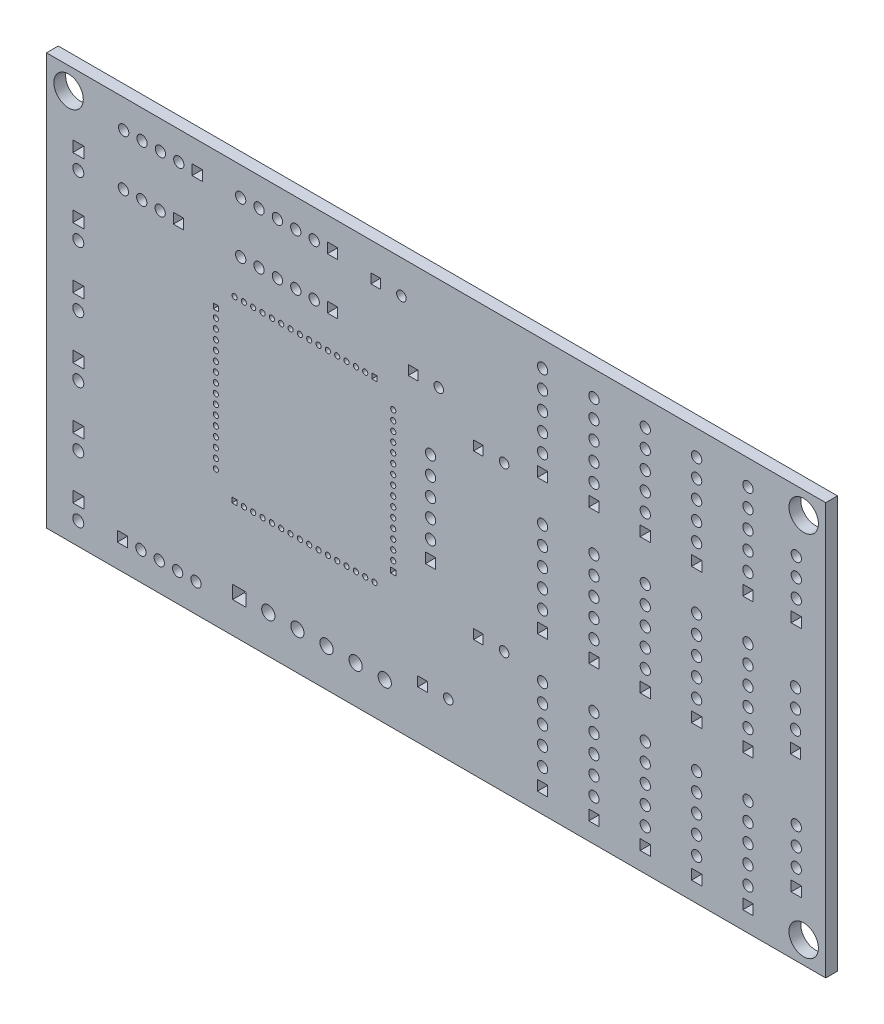
from build123d import *

# Parameters (mm, degrees)
MODEL_W             = 106
MODEL_H             = 56
MODEL_R             = 0.35
MODEL_R_2           = 0.75
MODEL_R_3           = 0.9
MODEL_R_4           = 0.7
MODEL_R_5           = 0.65
MODEL_R_6           = 2
MODEL_W_2           = 0.7
MODEL_H_2           = 0.7
MODEL_W_3           = 1.5
MODEL_H_3           = 1.5
MODEL_W_4           = 1.8
MODEL_H_4           = 1.8
MODEL_W_5           = 1.4
MODEL_H_5           = 1.4
MODEL_W_6           = 1.3
MODEL_H_6           = 1.3
BOSS_EXTRUDE1_DEPTH = 1.6


with BuildPart() as part:
    # Model → Boss-Extrude1 (new body)
    with BuildSketch(Plane.XY):
        with Locations((53, 28)):
            Rectangle(MODEL_W, MODEL_H)
        with Locations((23.035, 36.255)):
            Circle(MODEL_R, mode=Mode.SUBTRACT)
        with Locations((23.035, 34.985)):
            Circle(MODEL_R, mode=Mode.SUBTRACT)
        with Locations((23.035, 33.715)):
            Circle(MODEL_R, mode=Mode.SUBTRACT)
        with Locations((23.035, 32.445)):
            Circle(MODEL_R, mode=Mode.SUBTRACT)
        with Locations((23.035, 31.175)):
            Circle(MODEL_R, mode=Mode.SUBTRACT)
        with Locations((23.035, 29.905)):
            Circle(MODEL_R, mode=Mode.SUBTRACT)
        with Locations((23.035, 28.635)):
            Circle(MODEL_R, mode=Mode.SUBTRACT)
        with Locations((23.035, 27.365)):
            Circle(MODEL_R, mode=Mode.SUBTRACT)
        with Locations((23.035, 26.095)):
            Circle(MODEL_R, mode=Mode.SUBTRACT)
        with Locations((23.035, 24.825)):
            Circle(MODEL_R, mode=Mode.SUBTRACT)
        with Locations((23.035, 23.555)):
            Circle(MODEL_R, mode=Mode.SUBTRACT)
        with Locations((23.035, 22.285)):
            Circle(MODEL_R, mode=Mode.SUBTRACT)
        with Locations((23.035, 21.015)):
            Circle(MODEL_R, mode=Mode.SUBTRACT)
        with Locations((23.035, 19.745)):
            Circle(MODEL_R, mode=Mode.SUBTRACT)
        with Locations((23.035, 18.475)):
            Circle(MODEL_R, mode=Mode.SUBTRACT)
        with Locations((26.845, 15.935)):
            Circle(MODEL_R, mode=Mode.SUBTRACT)
        with Locations((28.115, 15.935)):
            Circle(MODEL_R, mode=Mode.SUBTRACT)
        with Locations((29.385, 15.935)):
            Circle(MODEL_R, mode=Mode.SUBTRACT)
        with Locations((30.655, 15.935)):
            Circle(MODEL_R, mode=Mode.SUBTRACT)
        with Locations((31.925, 15.935)):
            Circle(MODEL_R, mode=Mode.SUBTRACT)
        with Locations((33.195, 15.935)):
            Circle(MODEL_R, mode=Mode.SUBTRACT)
        with Locations((34.465, 15.935)):
            Circle(MODEL_R, mode=Mode.SUBTRACT)
        with Locations((35.735, 15.935)):
            Circle(MODEL_R, mode=Mode.SUBTRACT)
        with Locations((37.005, 15.935)):
            Circle(MODEL_R, mode=Mode.SUBTRACT)
        with Locations((38.275, 15.935)):
            Circle(MODEL_R, mode=Mode.SUBTRACT)
        with Locations((39.545, 15.935)):
            Circle(MODEL_R, mode=Mode.SUBTRACT)
        with Locations((40.815, 15.935)):
            Circle(MODEL_R, mode=Mode.SUBTRACT)
        with Locations((42.085, 15.935)):
            Circle(MODEL_R, mode=Mode.SUBTRACT)
        with Locations((43.355, 15.935)):
            Circle(MODEL_R, mode=Mode.SUBTRACT)
        with Locations((44.625, 15.935)):
            Circle(MODEL_R, mode=Mode.SUBTRACT)
        with Locations((47.165, 19.745)):
            Circle(MODEL_R, mode=Mode.SUBTRACT)
        with Locations((47.165, 21.015)):
            Circle(MODEL_R, mode=Mode.SUBTRACT)
        with Locations((47.165, 22.285)):
            Circle(MODEL_R, mode=Mode.SUBTRACT)
        with Locations((47.165, 23.555)):
            Circle(MODEL_R, mode=Mode.SUBTRACT)
        with Locations((47.165, 24.825)):
            Circle(MODEL_R, mode=Mode.SUBTRACT)
        with Locations((47.165, 26.095)):
            Circle(MODEL_R, mode=Mode.SUBTRACT)
        with Locations((47.165, 27.365)):
            Circle(MODEL_R, mode=Mode.SUBTRACT)
        with Locations((47.165, 28.635)):
            Circle(MODEL_R, mode=Mode.SUBTRACT)
        with Locations((47.165, 29.905)):
            Circle(MODEL_R, mode=Mode.SUBTRACT)
        with Locations((47.165, 31.175)):
            Circle(MODEL_R, mode=Mode.SUBTRACT)
        with Locations((47.165, 32.445)):
            Circle(MODEL_R, mode=Mode.SUBTRACT)
        with Locations((47.165, 33.715)):
            Circle(MODEL_R, mode=Mode.SUBTRACT)
        with Locations((47.165, 34.985)):
            Circle(MODEL_R, mode=Mode.SUBTRACT)
        with Locations((47.165, 36.255)):
            Circle(MODEL_R, mode=Mode.SUBTRACT)
        with Locations((47.165, 37.525)):
            Circle(MODEL_R, mode=Mode.SUBTRACT)
        with Locations((43.355, 40.065)):
            Circle(MODEL_R, mode=Mode.SUBTRACT)
        with Locations((42.085, 40.065)):
            Circle(MODEL_R, mode=Mode.SUBTRACT)
        with Locations((40.815, 40.065)):
            Circle(MODEL_R, mode=Mode.SUBTRACT)
        with Locations((39.545, 40.065)):
            Circle(MODEL_R, mode=Mode.SUBTRACT)
        with Locations((38.275, 40.065)):
            Circle(MODEL_R, mode=Mode.SUBTRACT)
        with Locations((37.005, 40.065)):
            Circle(MODEL_R, mode=Mode.SUBTRACT)
        with Locations((35.735, 40.065)):
            Circle(MODEL_R, mode=Mode.SUBTRACT)
        with Locations((34.465, 40.065)):
            Circle(MODEL_R, mode=Mode.SUBTRACT)
        with Locations((33.195, 40.065)):
            Circle(MODEL_R, mode=Mode.SUBTRACT)
        with Locations((31.925, 40.065)):
            Circle(MODEL_R, mode=Mode.SUBTRACT)
        with Locations((30.655, 40.065)):
            Circle(MODEL_R, mode=Mode.SUBTRACT)
        with Locations((29.385, 40.065)):
            Circle(MODEL_R, mode=Mode.SUBTRACT)
        with Locations((28.115, 40.065)):
            Circle(MODEL_R, mode=Mode.SUBTRACT)
        with Locations((26.845, 40.065)):
            Circle(MODEL_R, mode=Mode.SUBTRACT)
        with Locations((25.575, 40.065)):
            Circle(MODEL_R, mode=Mode.SUBTRACT)
        with Locations((4.32, 44.29)):
            Circle(MODEL_R_2, mode=Mode.SUBTRACT)
        with Locations((4.32, 36.035)):
            Circle(MODEL_R_2, mode=Mode.SUBTRACT)
        with Locations((4.32, 27.78)):
            Circle(MODEL_R_2, mode=Mode.SUBTRACT)
        with Locations((4.32, 19.525)):
            Circle(MODEL_R_2, mode=Mode.SUBTRACT)
        with Locations((4.32, 11.27)):
            Circle(MODEL_R_2, mode=Mode.SUBTRACT)
        with Locations((4.32, 3.015)):
            Circle(MODEL_R_2, mode=Mode.SUBTRACT)
        with Locations((30.17, 5.14)):
            Circle(MODEL_R_3, mode=Mode.SUBTRACT)
        with Locations((34.13, 5.14)):
            Circle(MODEL_R_3, mode=Mode.SUBTRACT)
        with Locations((38.09, 5.14)):
            Circle(MODEL_R_3, mode=Mode.SUBTRACT)
        with Locations((42.05, 5.14)):
            Circle(MODEL_R_3, mode=Mode.SUBTRACT)
        with Locations((46.01, 5.14)):
            Circle(MODEL_R_3, mode=Mode.SUBTRACT)
        with Locations((67.485, 5.6)):
            Circle(MODEL_R_4, mode=Mode.SUBTRACT)
        with Locations((67.485, 8.1)):
            Circle(MODEL_R_4, mode=Mode.SUBTRACT)
        with Locations((67.485, 10.6)):
            Circle(MODEL_R_4, mode=Mode.SUBTRACT)
        with Locations((67.485, 13.1)):
            Circle(MODEL_R_4, mode=Mode.SUBTRACT)
        with Locations((67.485, 15.6)):
            Circle(MODEL_R_4, mode=Mode.SUBTRACT)
        with Locations((74.47, 5.6)):
            Circle(MODEL_R_4, mode=Mode.SUBTRACT)
        with Locations((74.47, 8.1)):
            Circle(MODEL_R_4, mode=Mode.SUBTRACT)
        with Locations((74.47, 10.6)):
            Circle(MODEL_R_4, mode=Mode.SUBTRACT)
        with Locations((74.47, 13.1)):
            Circle(MODEL_R_4, mode=Mode.SUBTRACT)
        with Locations((74.47, 15.6)):
            Circle(MODEL_R_4, mode=Mode.SUBTRACT)
        with Locations((81.455, 5.6)):
            Circle(MODEL_R_4, mode=Mode.SUBTRACT)
        with Locations((81.455, 8.1)):
            Circle(MODEL_R_4, mode=Mode.SUBTRACT)
        with Locations((81.455, 10.6)):
            Circle(MODEL_R_4, mode=Mode.SUBTRACT)
        with Locations((81.455, 13.1)):
            Circle(MODEL_R_4, mode=Mode.SUBTRACT)
        with Locations((81.455, 15.6)):
            Circle(MODEL_R_4, mode=Mode.SUBTRACT)
        with Locations((88.44, 5.6)):
            Circle(MODEL_R_4, mode=Mode.SUBTRACT)
        with Locations((88.44, 8.1)):
            Circle(MODEL_R_4, mode=Mode.SUBTRACT)
        with Locations((88.44, 10.6)):
            Circle(MODEL_R_4, mode=Mode.SUBTRACT)
        with Locations((88.44, 13.1)):
            Circle(MODEL_R_4, mode=Mode.SUBTRACT)
        with Locations((88.44, 15.6)):
            Circle(MODEL_R_4, mode=Mode.SUBTRACT)
        with Locations((95.425, 5.6)):
            Circle(MODEL_R_4, mode=Mode.SUBTRACT)
        with Locations((95.425, 8.1)):
            Circle(MODEL_R_4, mode=Mode.SUBTRACT)
        with Locations((95.425, 10.6)):
            Circle(MODEL_R_4, mode=Mode.SUBTRACT)
        with Locations((95.425, 13.1)):
            Circle(MODEL_R_4, mode=Mode.SUBTRACT)
        with Locations((95.425, 15.6)):
            Circle(MODEL_R_4, mode=Mode.SUBTRACT)
        with Locations((67.485, 24.15)):
            Circle(MODEL_R_4, mode=Mode.SUBTRACT)
        with Locations((67.485, 26.65)):
            Circle(MODEL_R_4, mode=Mode.SUBTRACT)
        with Locations((67.485, 29.15)):
            Circle(MODEL_R_4, mode=Mode.SUBTRACT)
        with Locations((67.485, 31.65)):
            Circle(MODEL_R_4, mode=Mode.SUBTRACT)
        with Locations((67.485, 34.15)):
            Circle(MODEL_R_4, mode=Mode.SUBTRACT)
        with Locations((74.47, 24.15)):
            Circle(MODEL_R_4, mode=Mode.SUBTRACT)
        with Locations((74.47, 26.65)):
            Circle(MODEL_R_4, mode=Mode.SUBTRACT)
        with Locations((74.47, 29.15)):
            Circle(MODEL_R_4, mode=Mode.SUBTRACT)
        with Locations((74.47, 31.65)):
            Circle(MODEL_R_4, mode=Mode.SUBTRACT)
        with Locations((74.47, 34.15)):
            Circle(MODEL_R_4, mode=Mode.SUBTRACT)
        with Locations((81.455, 24.15)):
            Circle(MODEL_R_4, mode=Mode.SUBTRACT)
        with Locations((81.455, 26.65)):
            Circle(MODEL_R_4, mode=Mode.SUBTRACT)
        with Locations((81.455, 29.15)):
            Circle(MODEL_R_4, mode=Mode.SUBTRACT)
        with Locations((81.455, 31.65)):
            Circle(MODEL_R_4, mode=Mode.SUBTRACT)
        with Locations((81.455, 34.15)):
            Circle(MODEL_R_4, mode=Mode.SUBTRACT)
        with Locations((88.44, 24.15)):
            Circle(MODEL_R_4, mode=Mode.SUBTRACT)
        with Locations((88.44, 26.65)):
            Circle(MODEL_R_4, mode=Mode.SUBTRACT)
        with Locations((88.44, 29.15)):
            Circle(MODEL_R_4, mode=Mode.SUBTRACT)
        with Locations((88.44, 31.65)):
            Circle(MODEL_R_4, mode=Mode.SUBTRACT)
        with Locations((88.44, 34.15)):
            Circle(MODEL_R_4, mode=Mode.SUBTRACT)
        with Locations((95.425, 24.15)):
            Circle(MODEL_R_4, mode=Mode.SUBTRACT)
        with Locations((95.425, 26.65)):
            Circle(MODEL_R_4, mode=Mode.SUBTRACT)
        with Locations((95.425, 29.15)):
            Circle(MODEL_R_4, mode=Mode.SUBTRACT)
        with Locations((95.425, 31.65)):
            Circle(MODEL_R_4, mode=Mode.SUBTRACT)
        with Locations((95.425, 34.15)):
            Circle(MODEL_R_4, mode=Mode.SUBTRACT)
        with Locations((67.485, 42.565)):
            Circle(MODEL_R_4, mode=Mode.SUBTRACT)
        with Locations((67.485, 45.065)):
            Circle(MODEL_R_4, mode=Mode.SUBTRACT)
        with Locations((67.485, 47.565)):
            Circle(MODEL_R_4, mode=Mode.SUBTRACT)
        with Locations((67.485, 50.065)):
            Circle(MODEL_R_4, mode=Mode.SUBTRACT)
        with Locations((67.485, 52.565)):
            Circle(MODEL_R_4, mode=Mode.SUBTRACT)
        with Locations((74.47, 42.565)):
            Circle(MODEL_R_4, mode=Mode.SUBTRACT)
        with Locations((74.47, 45.065)):
            Circle(MODEL_R_4, mode=Mode.SUBTRACT)
        with Locations((74.47, 47.565)):
            Circle(MODEL_R_4, mode=Mode.SUBTRACT)
        with Locations((74.47, 50.065)):
            Circle(MODEL_R_4, mode=Mode.SUBTRACT)
        with Locations((74.47, 52.565)):
            Circle(MODEL_R_4, mode=Mode.SUBTRACT)
        with Locations((81.455, 42.565)):
            Circle(MODEL_R_4, mode=Mode.SUBTRACT)
        with Locations((81.455, 45.065)):
            Circle(MODEL_R_4, mode=Mode.SUBTRACT)
        with Locations((81.455, 47.565)):
            Circle(MODEL_R_4, mode=Mode.SUBTRACT)
        with Locations((81.455, 50.065)):
            Circle(MODEL_R_4, mode=Mode.SUBTRACT)
        with Locations((81.455, 52.565)):
            Circle(MODEL_R_4, mode=Mode.SUBTRACT)
        with Locations((88.44, 42.565)):
            Circle(MODEL_R_4, mode=Mode.SUBTRACT)
        with Locations((88.44, 45.065)):
            Circle(MODEL_R_4, mode=Mode.SUBTRACT)
        with Locations((88.44, 47.565)):
            Circle(MODEL_R_4, mode=Mode.SUBTRACT)
        with Locations((88.44, 50.065)):
            Circle(MODEL_R_4, mode=Mode.SUBTRACT)
        with Locations((88.44, 52.565)):
            Circle(MODEL_R_4, mode=Mode.SUBTRACT)
        with Locations((95.425, 42.565)):
            Circle(MODEL_R_4, mode=Mode.SUBTRACT)
        with Locations((95.425, 45.065)):
            Circle(MODEL_R_4, mode=Mode.SUBTRACT)
        with Locations((95.425, 47.565)):
            Circle(MODEL_R_4, mode=Mode.SUBTRACT)
        with Locations((95.425, 50.065)):
            Circle(MODEL_R_4, mode=Mode.SUBTRACT)
        with Locations((95.425, 52.565)):
            Circle(MODEL_R_4, mode=Mode.SUBTRACT)
        with Locations((36.41, 52.13)):
            Circle(MODEL_R_4, mode=Mode.SUBTRACT)
        with Locations((33.91, 52.13)):
            Circle(MODEL_R_4, mode=Mode.SUBTRACT)
        with Locations((31.41, 52.13)):
            Circle(MODEL_R_4, mode=Mode.SUBTRACT)
        with Locations((28.91, 52.13)):
            Circle(MODEL_R_4, mode=Mode.SUBTRACT)
        with Locations((26.41, 52.13)):
            Circle(MODEL_R_4, mode=Mode.SUBTRACT)
        with Locations((36.41, 45.145)):
            Circle(MODEL_R_4, mode=Mode.SUBTRACT)
        with Locations((33.91, 45.145)):
            Circle(MODEL_R_4, mode=Mode.SUBTRACT)
        with Locations((31.41, 45.145)):
            Circle(MODEL_R_4, mode=Mode.SUBTRACT)
        with Locations((28.91, 45.145)):
            Circle(MODEL_R_4, mode=Mode.SUBTRACT)
        with Locations((26.41, 45.145)):
            Circle(MODEL_R_4, mode=Mode.SUBTRACT)
        with Locations((52.245, 24.785)):
            Circle(MODEL_R_4, mode=Mode.SUBTRACT)
        with Locations((52.245, 27.285)):
            Circle(MODEL_R_4, mode=Mode.SUBTRACT)
        with Locations((52.245, 29.785)):
            Circle(MODEL_R_4, mode=Mode.SUBTRACT)
        with Locations((52.245, 32.285)):
            Circle(MODEL_R_4, mode=Mode.SUBTRACT)
        with Locations((52.245, 34.785)):
            Circle(MODEL_R_4, mode=Mode.SUBTRACT)
        with Locations((17.995, 52.13)):
            Circle(MODEL_R_4, mode=Mode.SUBTRACT)
        with Locations((15.495, 52.13)):
            Circle(MODEL_R_4, mode=Mode.SUBTRACT)
        with Locations((12.995, 52.13)):
            Circle(MODEL_R_4, mode=Mode.SUBTRACT)
        with Locations((10.495, 52.13)):
            Circle(MODEL_R_4, mode=Mode.SUBTRACT)
        with Locations((12.835, 3.87)):
            Circle(MODEL_R_4, mode=Mode.SUBTRACT)
        with Locations((15.335, 3.87)):
            Circle(MODEL_R_4, mode=Mode.SUBTRACT)
        with Locations((17.835, 3.87)):
            Circle(MODEL_R_4, mode=Mode.SUBTRACT)
        with Locations((20.335, 3.87)):
            Circle(MODEL_R_4, mode=Mode.SUBTRACT)
        with Locations((15.455, 45.145)):
            Circle(MODEL_R_4, mode=Mode.SUBTRACT)
        with Locations((12.955, 45.145)):
            Circle(MODEL_R_4, mode=Mode.SUBTRACT)
        with Locations((10.455, 45.145)):
            Circle(MODEL_R_4, mode=Mode.SUBTRACT)
        with Locations((102, 42.7)):
            Circle(MODEL_R_4, mode=Mode.SUBTRACT)
        with Locations((102, 45.2)):
            Circle(MODEL_R_4, mode=Mode.SUBTRACT)
        with Locations((102, 47.7)):
            Circle(MODEL_R_4, mode=Mode.SUBTRACT)
        with Locations((101.9, 27.2)):
            Circle(MODEL_R_4, mode=Mode.SUBTRACT)
        with Locations((101.9, 29.7)):
            Circle(MODEL_R_4, mode=Mode.SUBTRACT)
        with Locations((101.9, 32.2)):
            Circle(MODEL_R_4, mode=Mode.SUBTRACT)
        with Locations((102, 11)):
            Circle(MODEL_R_4, mode=Mode.SUBTRACT)
        with Locations((102, 13.5)):
            Circle(MODEL_R_4, mode=Mode.SUBTRACT)
        with Locations((102, 16)):
            Circle(MODEL_R_4, mode=Mode.SUBTRACT)
        with Locations((54.65, 7.2)):
            Circle(MODEL_R_5, mode=Mode.SUBTRACT)
        with Locations((62.25, 16.57)):
            Circle(MODEL_R_5, mode=Mode.SUBTRACT)
        with Locations((62.25, 38.795)):
            Circle(MODEL_R_5, mode=Mode.SUBTRACT)
        with Locations((48.28, 51.495)):
            Circle(MODEL_R_5, mode=Mode.SUBTRACT)
        with Locations((53.36, 43.24)):
            Circle(MODEL_R_5, mode=Mode.SUBTRACT)
        with Locations((3, 53)):
            Circle(MODEL_R_6, mode=Mode.SUBTRACT)
        with Locations((103, 3)):
            Circle(MODEL_R_6, mode=Mode.SUBTRACT)
        with Locations((103, 53)):
            Circle(MODEL_R_6, mode=Mode.SUBTRACT)
        with Locations((23.035, 37.525)):
            Rectangle(MODEL_W_2, MODEL_H_2, mode=Mode.SUBTRACT)
        with Locations((25.575, 15.935)):
            Rectangle(MODEL_W_2, MODEL_H_2, mode=Mode.SUBTRACT)
        with Locations((47.165, 18.475)):
            Rectangle(MODEL_W_2, MODEL_H_2, mode=Mode.SUBTRACT)
        with Locations((44.625, 40.065)):
            Rectangle(MODEL_W_2, MODEL_H_2, mode=Mode.SUBTRACT)
        with Locations((4.32, 46.79)):
            Rectangle(MODEL_W_3, MODEL_H_3, mode=Mode.SUBTRACT)
        with Locations((4.32, 38.535)):
            Rectangle(MODEL_W_3, MODEL_H_3, mode=Mode.SUBTRACT)
        with Locations((4.32, 30.28)):
            Rectangle(MODEL_W_3, MODEL_H_3, mode=Mode.SUBTRACT)
        with Locations((4.32, 22.025)):
            Rectangle(MODEL_W_3, MODEL_H_3, mode=Mode.SUBTRACT)
        with Locations((4.32, 13.77)):
            Rectangle(MODEL_W_3, MODEL_H_3, mode=Mode.SUBTRACT)
        with Locations((4.32, 5.515)):
            Rectangle(MODEL_W_3, MODEL_H_3, mode=Mode.SUBTRACT)
        with Locations((26.21, 5.14)):
            Rectangle(MODEL_W_4, MODEL_H_4, mode=Mode.SUBTRACT)
        with Locations((67.485, 3.1)):
            Rectangle(MODEL_W_5, MODEL_H_5, mode=Mode.SUBTRACT)
        with Locations((74.47, 3.1)):
            Rectangle(MODEL_W_5, MODEL_H_5, mode=Mode.SUBTRACT)
        with Locations((81.455, 3.1)):
            Rectangle(MODEL_W_5, MODEL_H_5, mode=Mode.SUBTRACT)
        with Locations((88.44, 3.1)):
            Rectangle(MODEL_W_5, MODEL_H_5, mode=Mode.SUBTRACT)
        with Locations((95.425, 3.1)):
            Rectangle(MODEL_W_5, MODEL_H_5, mode=Mode.SUBTRACT)
        with Locations((67.485, 21.65)):
            Rectangle(MODEL_W_5, MODEL_H_5, mode=Mode.SUBTRACT)
        with Locations((74.47, 21.65)):
            Rectangle(MODEL_W_5, MODEL_H_5, mode=Mode.SUBTRACT)
        with Locations((81.455, 21.65)):
            Rectangle(MODEL_W_5, MODEL_H_5, mode=Mode.SUBTRACT)
        with Locations((88.44, 21.65)):
            Rectangle(MODEL_W_5, MODEL_H_5, mode=Mode.SUBTRACT)
        with Locations((95.425, 21.65)):
            Rectangle(MODEL_W_5, MODEL_H_5, mode=Mode.SUBTRACT)
        with Locations((67.485, 40.065)):
            Rectangle(MODEL_W_5, MODEL_H_5, mode=Mode.SUBTRACT)
        with Locations((74.47, 40.065)):
            Rectangle(MODEL_W_5, MODEL_H_5, mode=Mode.SUBTRACT)
        with Locations((81.455, 40.065)):
            Rectangle(MODEL_W_5, MODEL_H_5, mode=Mode.SUBTRACT)
        with Locations((88.44, 40.065)):
            Rectangle(MODEL_W_5, MODEL_H_5, mode=Mode.SUBTRACT)
        with Locations((95.425, 40.065)):
            Rectangle(MODEL_W_5, MODEL_H_5, mode=Mode.SUBTRACT)
        with Locations((38.91, 52.13)):
            Rectangle(MODEL_W_5, MODEL_H_5, mode=Mode.SUBTRACT)
        with Locations((38.91, 45.145)):
            Rectangle(MODEL_W_5, MODEL_H_5, mode=Mode.SUBTRACT)
        with Locations((52.245, 22.285)):
            Rectangle(MODEL_W_5, MODEL_H_5, mode=Mode.SUBTRACT)
        with Locations((20.495, 52.13)):
            Rectangle(MODEL_W_5, MODEL_H_5, mode=Mode.SUBTRACT)
        with Locations((10.335, 3.87)):
            Rectangle(MODEL_W_5, MODEL_H_5, mode=Mode.SUBTRACT)
        with Locations((17.955, 45.145)):
            Rectangle(MODEL_W_5, MODEL_H_5, mode=Mode.SUBTRACT)
        with Locations((102, 40.2)):
            Rectangle(MODEL_W_5, MODEL_H_5, mode=Mode.SUBTRACT)
        with Locations((101.9, 24.7)):
            Rectangle(MODEL_W_5, MODEL_H_5, mode=Mode.SUBTRACT)
        with Locations((102, 8.5)):
            Rectangle(MODEL_W_5, MODEL_H_5, mode=Mode.SUBTRACT)
        with Locations((51.15, 7.2)):
            Rectangle(MODEL_W_6, MODEL_H_6, mode=Mode.SUBTRACT)
        with Locations((58.75, 16.57)):
            Rectangle(MODEL_W_6, MODEL_H_6, mode=Mode.SUBTRACT)
        with Locations((58.75, 38.795)):
            Rectangle(MODEL_W_6, MODEL_H_6, mode=Mode.SUBTRACT)
        with Locations((44.78, 51.495)):
            Rectangle(MODEL_W_6, MODEL_H_6, mode=Mode.SUBTRACT)
        with Locations((49.86, 43.24)):
            Rectangle(MODEL_W_6, MODEL_H_6, mode=Mode.SUBTRACT)
    extrude(amount=BOSS_EXTRUDE1_DEPTH)


solid = part.part
